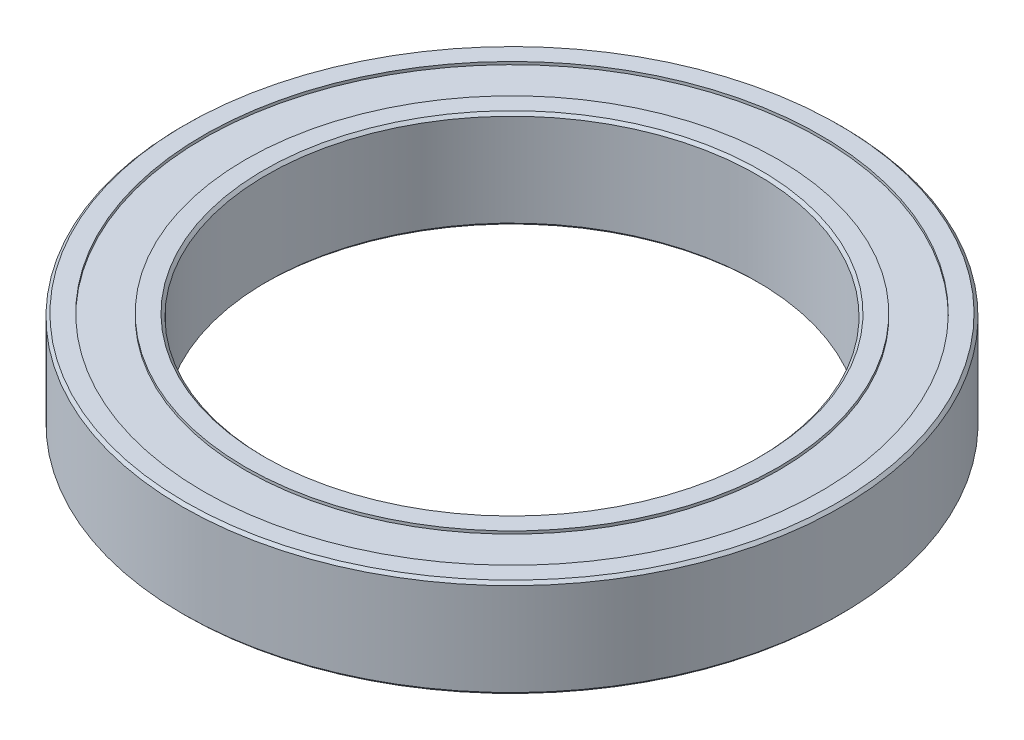
from build123d import *

# Parameters (mm, degrees)
SKETCH1_R           = 23.5
SKETCH1_R_2         = 17.5
BOSS_EXTRUDE1_DEPTH = 7
SKETCH2_R           = 22
SKETCH2_R_2         = 19
CUT_EXTRUDE1_DEPTH  = 0.2
CUT_EXTRUDE2_START  = -0.2
SKETCH3_R           = 22
SKETCH3_R_2         = 19
CUT_EXTRUDE2_DEPTH  = 0.2
CHAMFER1_SIZE       = 0.2


with BuildPart() as part:
    # Sketch1 → Boss-Extrude1 (new body)
    with BuildSketch(Plane(origin=(0, 0, 0), x_dir=(1, 0, 0), z_dir=(0, 1, 0))):
        with Locations(Location((0, 0, 0), (0, 0, 270))):
            Circle(SKETCH1_R)
        with Locations(Location((0, 0, 0), (0, 0, 270))):
            Circle(SKETCH1_R_2, mode=Mode.SUBTRACT)
    extrude(amount=BOSS_EXTRUDE1_DEPTH)

    # Sketch2 → Cut-Extrude1 (cut)
    with BuildSketch(Plane(origin=(0, 7, 0), x_dir=(1, 0, 0), z_dir=(0, 1, 0))):
        with Locations(Location((0, 0, 0), (0, 0, 270))):
            Circle(SKETCH2_R)
        with Locations(Location((0, 0, 0), (0, 0, 270))):
            Circle(SKETCH2_R_2, mode=Mode.SUBTRACT)
    extrude(amount=-CUT_EXTRUDE1_DEPTH, mode=Mode.SUBTRACT)

    # Sketch3 → Cut-Extrude2 (cut)
    with BuildSketch(Plane.XZ.offset(CUT_EXTRUDE2_START)):
        with Locations(Location((0, 0, 0), (0, 0, 90))):
            Circle(SKETCH3_R)
        with Locations(Location((0, 0, 0), (0, 0, 90))):
            Circle(SKETCH3_R_2, mode=Mode.SUBTRACT)
    extrude(amount=CUT_EXTRUDE2_DEPTH, mode=Mode.SUBTRACT)

    # Chamfer1
    chamfer1_edges = [part.edges().sort_by_distance(p)[0] for p in [
        (0, 0, -23.5),
        (0, 7, -23.5),
        (0, 0, -17.5),
        (0, 7, -17.5),
    ]]
    chamfer(chamfer1_edges, length=CHAMFER1_SIZE)


solid = part.part
